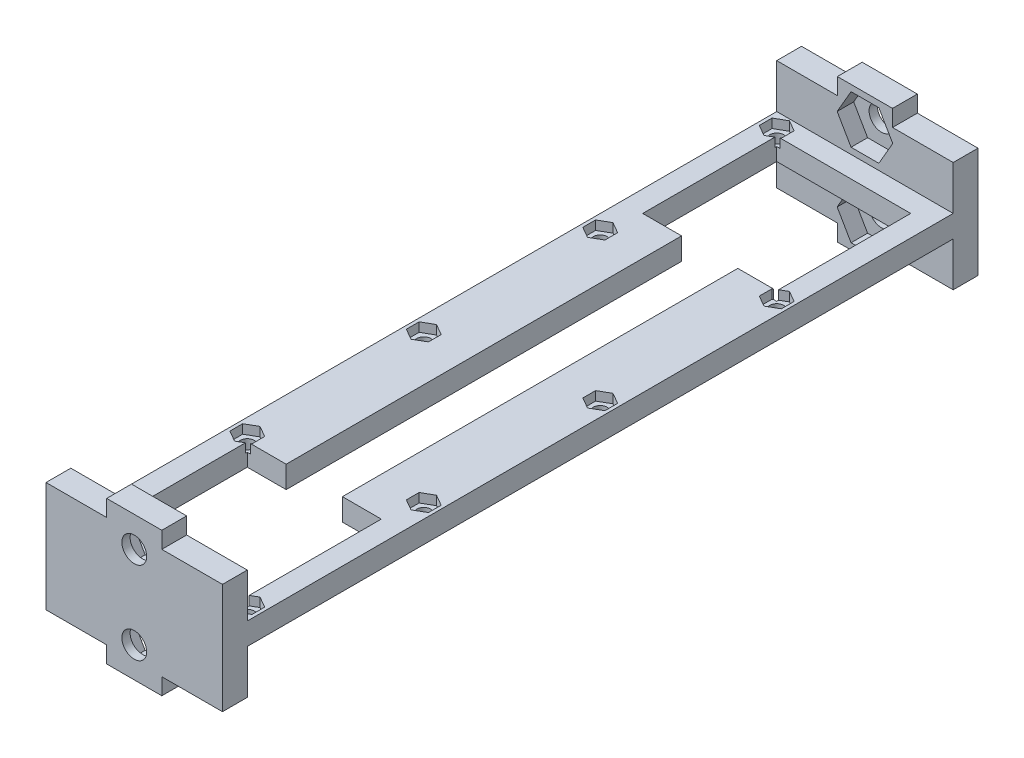
from build123d import *

# Parameters (mm, degrees)
SKETCH1_W               = 32
SKETCH1_H               = 128
BOSS_EXTRUDE1_DEPTH     = 4
SKETCH4_R               = 1.25
CUT_EXTRUDE2_DEPTH      = 10
SKETCH5_R               = 1.25
CUT_EXTRUDE3_DEPTH      = 10
CUT_EXTRUDE4_DEPTH      = 1.65
LPATTERN3_COUNT         = 4
LPATTERN3_PITCH         = 32
CUT_EXTRUDE5_DEPTH      = 1.65
LPATTERN4_COUNT         = 4
LPATTERN4_PITCH         = 32
SKETCH8_W               = 24.3
SKETCH8_H               = 24.3
CUT_EXTRUDE6_DEPTH      = 10
BOSS_EXTRUDE2_DEPTH     = 4.5
SKETCH11_W              = 10.2
SKETCH11_H              = 71.7
CUT_EXTRUDE7_DEPTH      = 72.92530848
CUT_EXTRUDE8_DEPTH      = 3
SKETCH12_R              = 2.25
CUT_EXTRUDE9_DEPTH      = 3
MIRROR3_COPY_1_DEPTH    = 3
MIRROR3_COPY_2_SKETCH_R = 2.25
MIRROR3_COPY_2_DEPTH    = 3


with BuildPart() as part:
    # Sketch1 → Boss-Extrude1 (new body)
    with BuildSketch(Plane(origin=(0, 0, 0), x_dir=(1, 0, 0), z_dir=(0, 1, 0))):
        Rectangle(SKETCH1_W, SKETCH1_H)
    extrude(amount=BOSS_EXTRUDE1_DEPTH)

    # Sketch4 → Cut-Extrude2 (cut)
    with BuildSketch(Plane.XZ):
        with Locations(Location((13.4, 61.4, 0), (0, 0, 270))):
            Circle(SKETCH4_R)
    cut_extrude2 = extrude(amount=-CUT_EXTRUDE2_DEPTH, mode=Mode.SUBTRACT)

    # Sketch5 → Cut-Extrude3 (cut)
    with BuildSketch(Plane.XZ):
        with Locations(Location((-13.4, -61.4, 0), (0, 0, 270))):
            Circle(SKETCH5_R)
    cut_extrude3 = extrude(amount=-CUT_EXTRUDE3_DEPTH, mode=Mode.SUBTRACT)

    # Sketch6 → Cut-Extrude4 (cut)
    with BuildSketch(Plane(origin=(0, 4, 0), x_dir=(1, 0, 0), z_dir=(0, 1, 0))):
        Polygon((-15.400518683, 62.555), (-13.4, 63.71), (-11.399481317, 62.555), (-11.399481317, 60.245), (-13.4, 59.09), (-15.400518683, 60.245), align=None)
    cut_extrude4 = extrude(amount=-CUT_EXTRUDE4_DEPTH, mode=Mode.SUBTRACT)

    # LPattern3: Cut-Extrude3, Cut-Extrude4 ×4
    with Locations(*[(0, 0, i * LPATTERN3_PITCH) for i in range(1, LPATTERN3_COUNT)]):
        add(cut_extrude3, mode=Mode.SUBTRACT)
        add(cut_extrude4, mode=Mode.SUBTRACT)

    # Sketch7 → Cut-Extrude5 (cut)
    with BuildSketch(Plane(origin=(0, 4, 0), x_dir=(1, 0, 0), z_dir=(0, 1, 0))):
        Polygon((13.4, -59.09), (11.399481317, -60.245), (11.399481317, -62.555), (13.4, -63.71), (15.400518683, -62.555), (15.400518683, -60.245), align=None)
    cut_extrude5 = extrude(amount=-CUT_EXTRUDE5_DEPTH, mode=Mode.SUBTRACT)

    # LPattern4: Cut-Extrude2, Cut-Extrude5 ×4
    with Locations(*[(0, 0, -i * LPATTERN4_PITCH) for i in range(1, LPATTERN4_COUNT)]):
        add(cut_extrude2, mode=Mode.SUBTRACT)
        add(cut_extrude5, mode=Mode.SUBTRACT)

    # Sketch8 → Cut-Extrude6 (cut)
    with BuildSketch(Plane.XZ):
        with Locations((0, 48)):
            Rectangle(SKETCH8_W, SKETCH8_H)
    cut_extrude6 = extrude(amount=-CUT_EXTRUDE6_DEPTH, mode=Mode.SUBTRACT)

    # Mirror1: Cut-Extrude6 across plane
    add(cut_extrude6.mirror(Plane.XY), mode=Mode.SUBTRACT)

    # Sketch9 → Boss-Extrude2 (add)
    with BuildSketch(Plane(origin=(0, 0, -64), x_dir=(-1, 0, 0), z_dir=(0, 0, -1))):
        Polygon((-16, 12), (-5, 12), (-5, 15), (5, 15), (5, 12), (16, 12), (16, -8), (5, -8), (5, -11), (-5, -11), (-5, -8), (-16, -8), align=None)
    boss_extrude2 = extrude(amount=BOSS_EXTRUDE2_DEPTH)

    # Sketch11 → Cut-Extrude7 (cut, through all)
    with BuildSketch(Plane.XZ):
        Rectangle(SKETCH11_W, SKETCH11_H)
    extrude(amount=-CUT_EXTRUDE7_DEPTH, mode=Mode.SUBTRACT)

    # Sketch10 → Cut-Extrude8 (cut)
    with BuildSketch(Plane.XY.offset(-64)):
        Polygon((-2.52, 13.864768035), (2.52, 13.864768035), (5.04, 9.5), (2.52, 5.135231965), (-2.52, 5.135231965), (-5.04, 9.5), align=None)
    cut_extrude8 = extrude(amount=-CUT_EXTRUDE8_DEPTH, mode=Mode.SUBTRACT)

    # Sketch12 → Cut-Extrude9 (cut)
    with BuildSketch(Plane.XY.offset(-67)):
        with Locations((0, 9.5)):
            Circle(SKETCH12_R)
    cut_extrude9 = extrude(amount=-CUT_EXTRUDE9_DEPTH, mode=Mode.SUBTRACT)

    # Mirror2: Cut-Extrude8, Cut-Extrude9 across plane
    add(cut_extrude8.mirror(Plane.ZX.offset(2)), mode=Mode.SUBTRACT)
    add(cut_extrude9.mirror(Plane.ZX.offset(2)), mode=Mode.SUBTRACT)

    # Mirror3: Boss-Extrude2, Cut-Extrude8, Cut-Extrude9 across plane
    add(boss_extrude2.mirror(Plane.XY))
    add(cut_extrude8.mirror(Plane.XY), mode=Mode.SUBTRACT)
    add(cut_extrude9.mirror(Plane.XY), mode=Mode.SUBTRACT)

    # Mirror3 copy 1 sketch → Mirror3 copy 1 (cut)
    with BuildSketch(Plane(origin=(0, 4, 64), x_dir=(1, 0, 0), z_dir=(0, 0, -1))):
        Polygon((-2.52, 13.864768035), (2.52, 13.864768035), (5.04, 9.5), (2.52, 5.135231965), (-2.52, 5.135231965), (-5.04, 9.5), align=None)
    extrude(amount=-MIRROR3_COPY_1_DEPTH, mode=Mode.SUBTRACT)

    # Mirror3 copy 2 sketch → Mirror3 copy 2 (cut)
    with BuildSketch(Plane(origin=(0, 4, 67), x_dir=(1, 0, 0), z_dir=(0, 0, -1))):
        with Locations((0, 9.5)):
            Circle(MIRROR3_COPY_2_SKETCH_R)
    extrude(amount=-MIRROR3_COPY_2_DEPTH, mode=Mode.SUBTRACT)


solid = part.part
